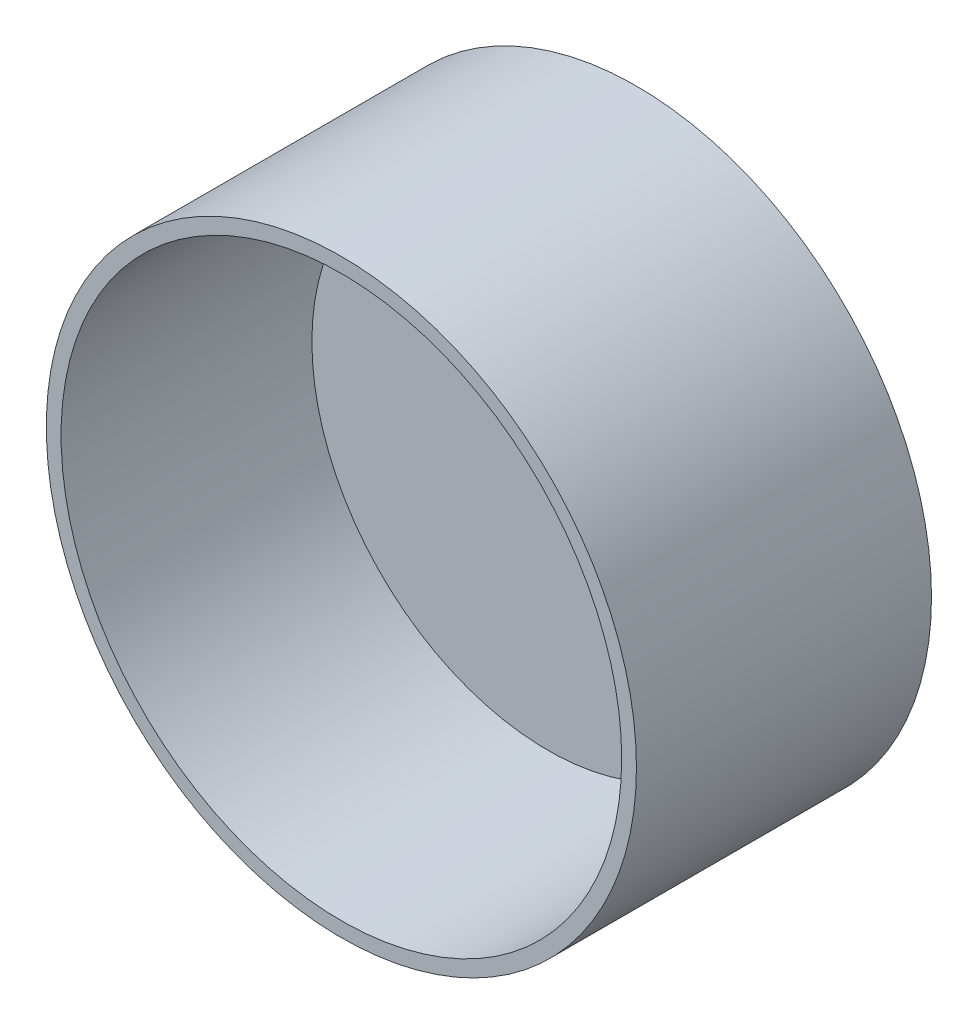
from build123d import *

# Parameters (mm, degrees)
SKETCH_11_R     = 100
SKETCH_11_R_2   = 95
EXTRUDE_4_DEPTH = 100
SKETCH_12_R     = 80
EXTRUDE_5_DEPTH = 30


with BuildPart() as part:
    # 草图11 → 凸台-拉伸4 (new body)
    with BuildSketch(Plane.XY):
        Circle(SKETCH_11_R)
        Circle(SKETCH_11_R_2, mode=Mode.SUBTRACT)
    extrude(amount=EXTRUDE_4_DEPTH)


with BuildPart() as body_2:
    # 草图12 → 凸台-拉伸5 (new body)
    with BuildSketch(Plane(origin=(0, 0, 0), x_dir=(-1, 0, 0), z_dir=(0, 0, -1))):
        Circle(SKETCH_12_R)
    extrude(amount=-EXTRUDE_5_DEPTH)


solid = Compound([part.part, body_2.part])
